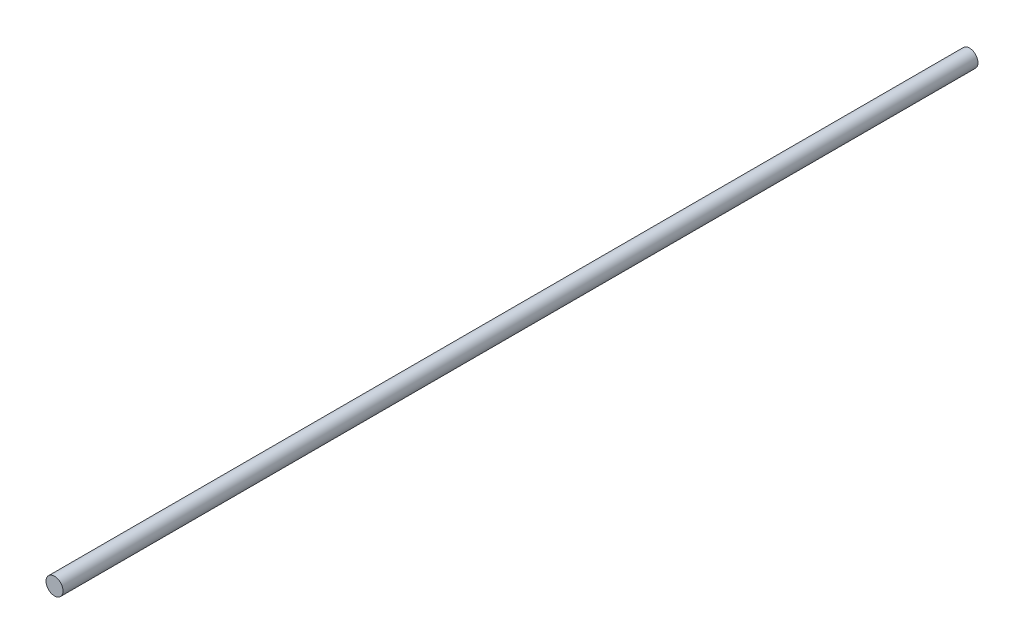
from build123d import *

# Parameters (mm, degrees)
SKETCH1_R           = 3
BOSS_EXTRUDE1_DEPTH = 322


with BuildPart() as part:
    # Sketch1 → Boss-Extrude1 (new body)
    with BuildSketch(Plane.XY):
        Circle(SKETCH1_R)
    extrude(amount=BOSS_EXTRUDE1_DEPTH)


solid = part.part
